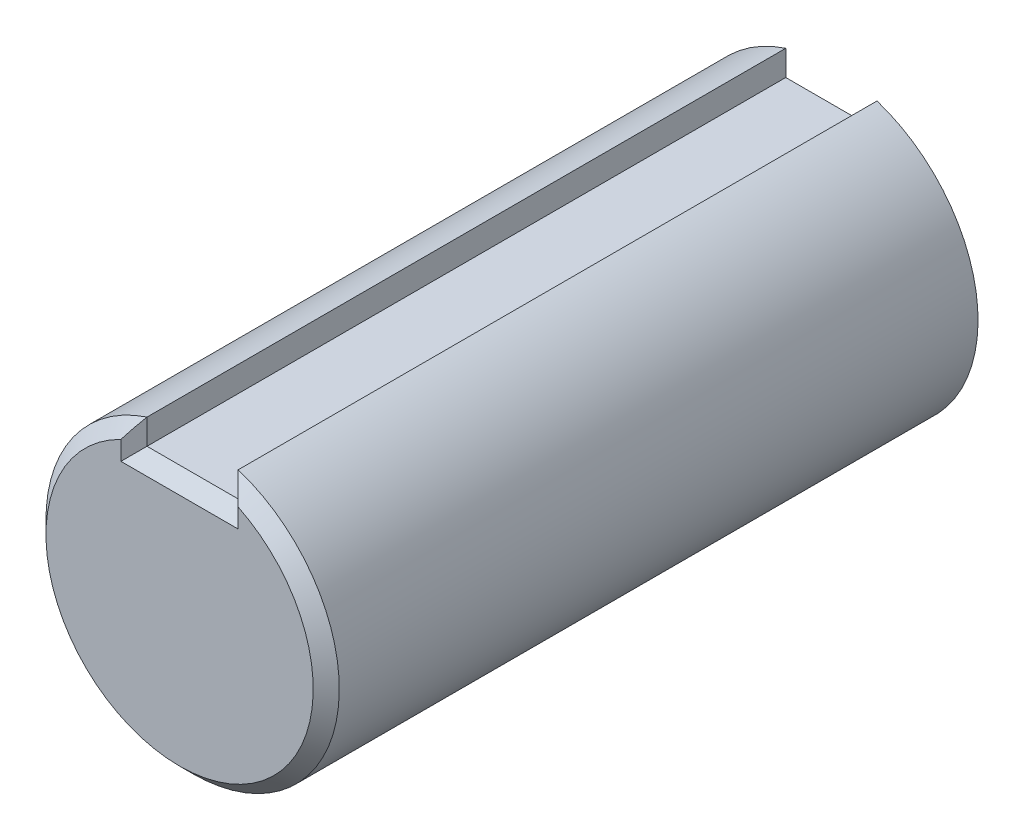
from build123d import *

# Parameters (mm, degrees)
SKETCH1_R           = 22.5
BOSS_EXTRUDE1_DEPTH = 100
SKETCH2_W           = 14
SKETCH2_H           = 8.804237579
CUT_EXTRUDE1_DEPTH  = 105.940459309
CHAMFER1_SIZE       = 2


with BuildPart() as part:
    # Sketch1 → Boss-Extrude1 (new body)
    with BuildSketch(Plane.XY):
        Circle(SKETCH1_R)
    extrude(amount=BOSS_EXTRUDE1_DEPTH)

    # Sketch2 → Cut-Extrude1 (cut, through all)
    with BuildSketch(Plane.XY.offset(100)):
        with Locations((0, 21.90211879)):
            Rectangle(SKETCH2_W, SKETCH2_H)
    extrude(amount=-CUT_EXTRUDE1_DEPTH, mode=Mode.SUBTRACT)

    # Chamfer1
    chamfer1_edges = [part.edges().sort_by_distance(p)[0] for p in [
        (0, -22.5, 100),
        (-7, 19.44170239, 100),
        (0, 17.5, 100),
        (7, 19.44170239, 100),
    ]]
    chamfer(chamfer1_edges, length=CHAMFER1_SIZE)


solid = part.part
